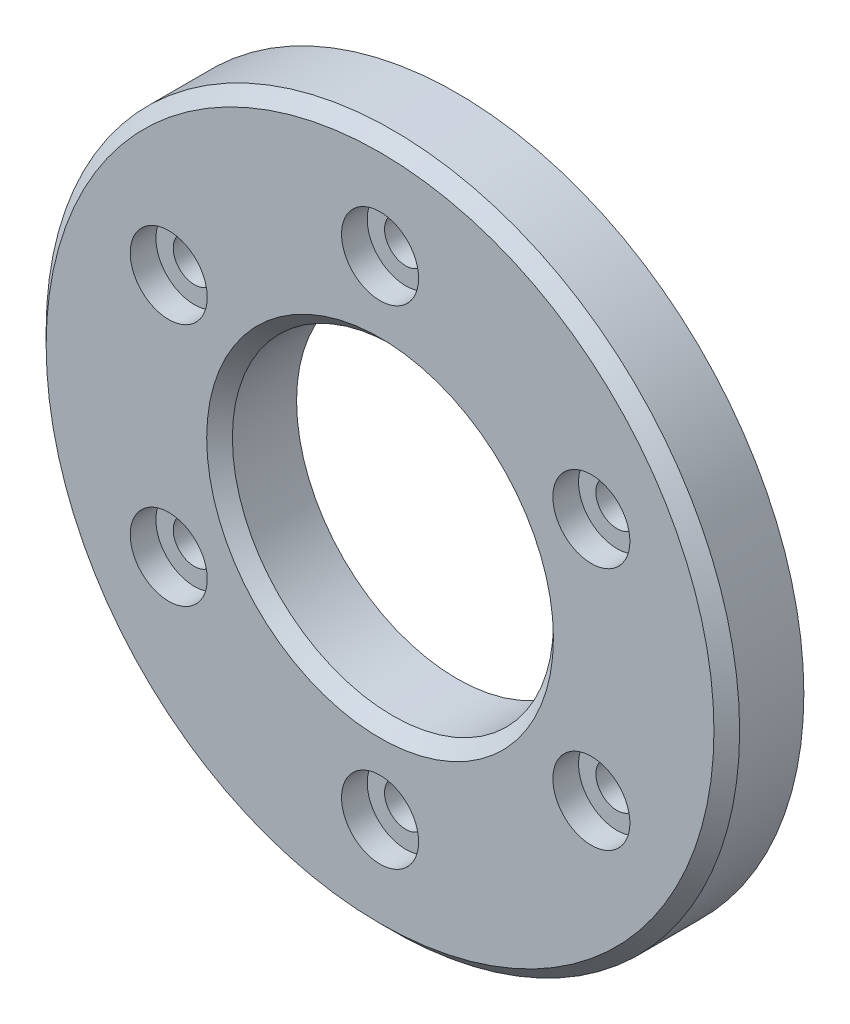
from build123d import *

# Parameters (mm, degrees)
SKETCH1_R           = 27
SKETCH1_R_2         = 1.65
SKETCH1_R_3         = 12.5
BOSS_EXTRUDE1_DEPTH = 6
SKETCH2_R           = 3
CUT_EXTRUDE1_DEPTH  = 2
CHAMFER1_SIZE       = 1


with BuildPart() as part:
    # Sketch1 → Boss-Extrude1 (new body)
    with BuildSketch(Plane.XY):
        Circle(SKETCH1_R)
        with Locations((0, 19)):
            Circle(SKETCH1_R_2, mode=Mode.SUBTRACT)
        with Locations((16.454482672, 9.5)):
            Circle(SKETCH1_R_2, mode=Mode.SUBTRACT)
        with Locations((16.454482672, -9.5)):
            Circle(SKETCH1_R_2, mode=Mode.SUBTRACT)
        with Locations((0, -19)):
            Circle(SKETCH1_R_2, mode=Mode.SUBTRACT)
        with Locations((-16.454482672, -9.5)):
            Circle(SKETCH1_R_2, mode=Mode.SUBTRACT)
        with Locations((-16.454482672, 9.5)):
            Circle(SKETCH1_R_2, mode=Mode.SUBTRACT)
        Circle(SKETCH1_R_3, mode=Mode.SUBTRACT)
    extrude(amount=BOSS_EXTRUDE1_DEPTH)

    # Sketch2 → Cut-Extrude1 (cut)
    with BuildSketch(Plane.XY.offset(6)):
        with Locations((0, 19)):
            Circle(SKETCH2_R)
        with Locations((16.454482672, 9.5)):
            Circle(SKETCH2_R)
        with Locations((16.454482672, -9.5)):
            Circle(SKETCH2_R)
        with Locations((0, -19)):
            Circle(SKETCH2_R)
        with Locations((-16.454482672, -9.5)):
            Circle(SKETCH2_R)
        with Locations((-16.454482672, 9.5)):
            Circle(SKETCH2_R)
    extrude(amount=-CUT_EXTRUDE1_DEPTH, mode=Mode.SUBTRACT)

    # Chamfer1
    chamfer1_edges = [part.edges().sort_by_distance(p)[0] for p in [
        (-27, 0, 6),
        (-12.5, 0, 6),
    ]]
    chamfer(chamfer1_edges, length=CHAMFER1_SIZE)


solid = part.part
